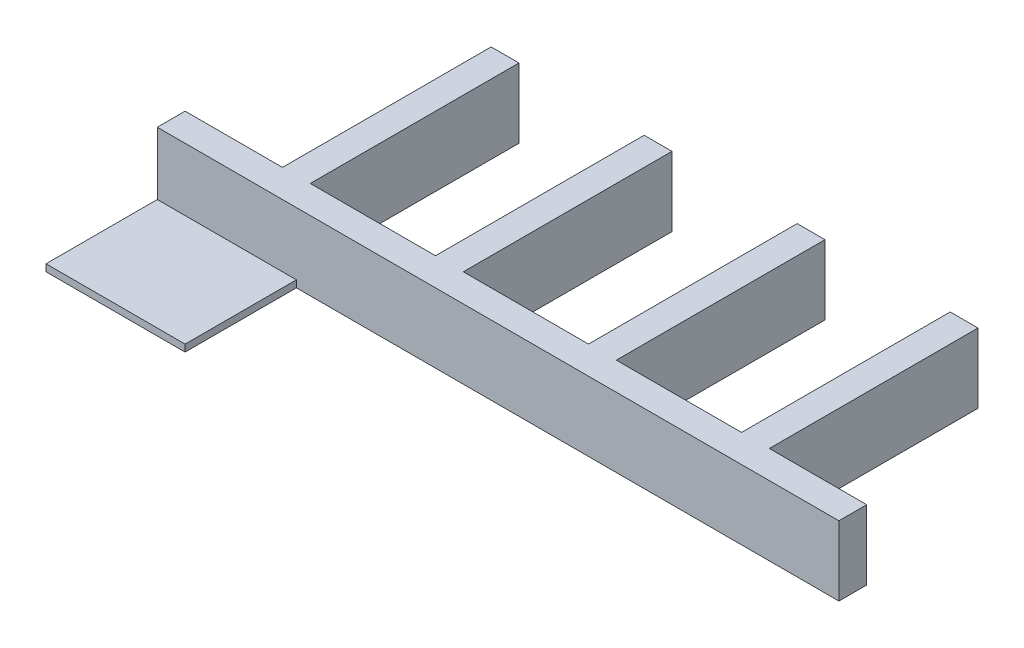
from build123d import *

# Parameters (mm, degrees)
BOSS_EXTRUDE1_DEPTH = 50
SKETCH2_W           = 100
SKETCH2_H           = 5
BOSS_EXTRUDE2_DEPTH = 80


with BuildPart() as part:
    # Sketch1 → Boss-Extrude1 (new body)
    with BuildSketch(Plane(origin=(0, 0, 0), x_dir=(1, 0, 0), z_dir=(0, 1, 0))):
        Polygon((0, 0), (490, 0), (490, 20), (420, 20), (420, 170), (400, 170), (400, 20), (310, 20), (310, 170), (290, 170), (290, 20), (200, 20), (200, 170), (180, 170), (180, 20), (90, 20), (90, 170), (70, 170), (70, 20), (0, 20), align=None)
    extrude(amount=BOSS_EXTRUDE1_DEPTH)

    # Sketch2 → Boss-Extrude2 (add)
    with BuildSketch(Plane.XY):
        with Locations((50, 2.5)):
            Rectangle(SKETCH2_W, SKETCH2_H)
    extrude(amount=BOSS_EXTRUDE2_DEPTH)


solid = part.part
